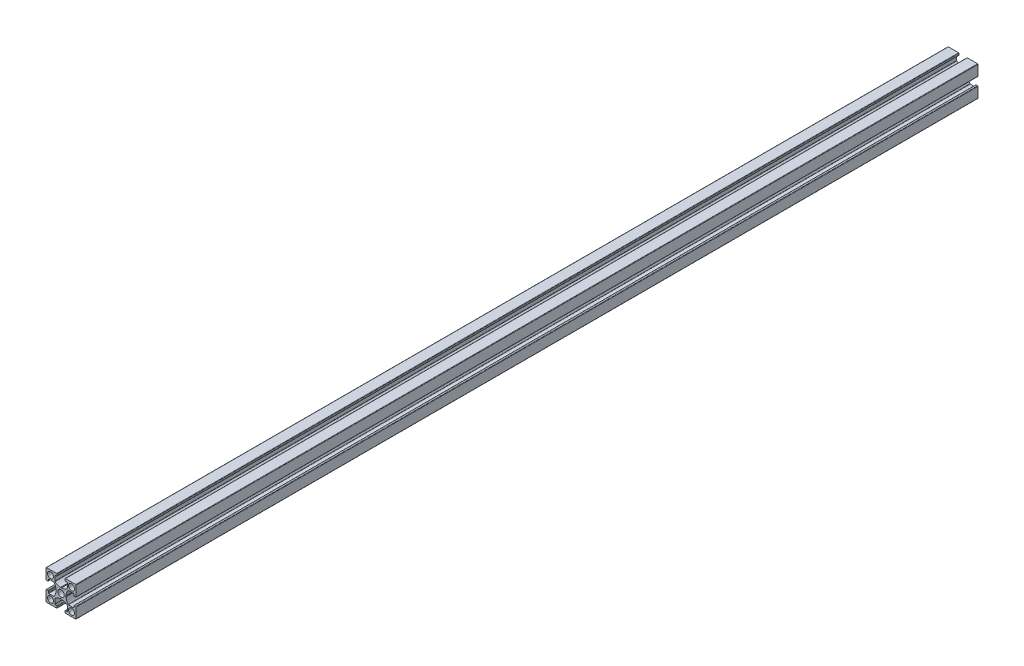
from build123d import *

# Parameters (mm, degrees)
MODEL_R         = 2.15
MODEL_R_2       = 2
EXTRUDE_1_DEPTH = 600


with BuildPart() as part:
    # Model → 보스-돌출1 (new body)
    with BuildSketch(Plane.XY):
        with BuildLine():
            Line((2307.763927197, 1192.134297913), (2307.763927197, 1195.391548465))
            ThreePointArc((2307.763927197, 1195.391548465), (2307.676059232, 1195.603680499), (2307.463927197, 1195.691548465))
            Line((2307.463927197, 1195.691548465), (2306.563927197, 1195.691548465))
            ThreePointArc((2306.563927197, 1195.691548465), (2306.351795163, 1195.779416431), (2306.263927197, 1195.991548465))
            Line((2306.263927197, 1195.991548465), (2306.263927197, 1196.891548465))
            ThreePointArc((2306.263927197, 1196.891548465), (2306.351795163, 1197.103680499), (2306.563927197, 1197.191548465))
            Line((2306.563927197, 1197.191548465), (2313.313927197, 1197.191548465))
            ThreePointArc((2313.313927197, 1197.191548465), (2313.526059232, 1197.103680499), (2313.613927197, 1196.891548465))
            Line((2313.613927197, 1196.891548465), (2313.613927197, 1190.141548465))
            ThreePointArc((2313.613927197, 1190.141548465), (2313.526059232, 1189.929416431), (2313.313927197, 1189.841548465))
            Line((2313.313927197, 1189.841548465), (2312.413927197, 1189.841548465))
            ThreePointArc((2312.413927197, 1189.841548465), (2312.201795163, 1189.929416431), (2312.113927197, 1190.141548465))
            Line((2312.113927197, 1190.141548465), (2312.113927197, 1191.041548465))
            ThreePointArc((2312.113927197, 1191.041548465), (2312.026059232, 1191.253680499), (2311.813927197, 1191.341548465))
            Line((2311.813927197, 1191.341548465), (2308.556676645, 1191.341548465))
            ThreePointArc((2308.556676645, 1191.341548465), (2308.426234796, 1191.311705686), (2308.321744595, 1191.228114625))
            ThreePointArc((2308.321744595, 1191.228114625), (2307.328306374, 1189.47356999), (2306.921204563, 1187.498825831))
            Line((2306.921204563, 1187.498825831), (2306.613927197, 1187.191548465))
            Line((2306.613927197, 1187.191548465), (2306.921204563, 1186.884271099))
            ThreePointArc((2306.921204563, 1186.884271099), (2307.328306374, 1184.90952694), (2308.321744595, 1183.154982305))
            ThreePointArc((2308.321744595, 1183.154982305), (2308.426234796, 1183.071391244), (2308.556676645, 1183.041548465))
            Line((2308.556676645, 1183.041548465), (2311.813927197, 1183.041548465))
            ThreePointArc((2311.813927197, 1183.041548465), (2312.026059232, 1183.129416431), (2312.113927197, 1183.341548465))
            Line((2312.113927197, 1183.341548465), (2312.113927197, 1184.241548465))
            ThreePointArc((2312.113927197, 1184.241548465), (2312.201795163, 1184.453680499), (2312.413927197, 1184.541548465))
            Line((2312.413927197, 1184.541548465), (2313.313927197, 1184.541548465))
            ThreePointArc((2313.313927197, 1184.541548465), (2313.526059232, 1184.453680499), (2313.613927197, 1184.241548465))
            Line((2313.613927197, 1184.241548465), (2313.613927197, 1177.491548465))
            ThreePointArc((2313.613927197, 1177.491548465), (2313.526059232, 1177.279416431), (2313.313927197, 1177.191548465))
            Line((2313.313927197, 1177.191548465), (2306.563927197, 1177.191548465))
            ThreePointArc((2306.563927197, 1177.191548465), (2306.351795163, 1177.279416431), (2306.263927197, 1177.491548465))
            Line((2306.263927197, 1177.491548465), (2306.263927197, 1178.391548465))
            ThreePointArc((2306.263927197, 1178.391548465), (2306.351795163, 1178.603680499), (2306.563927197, 1178.691548465))
            Line((2306.563927197, 1178.691548465), (2307.463927197, 1178.691548465))
            ThreePointArc((2307.463927197, 1178.691548465), (2307.676059232, 1178.779416431), (2307.763927197, 1178.991548465))
            Line((2307.763927197, 1178.991548465), (2307.763927197, 1182.248799017))
            ThreePointArc((2307.763927197, 1182.248799017), (2307.734084418, 1182.379240866), (2307.650493357, 1182.483731067))
            ThreePointArc((2307.650493357, 1182.483731067), (2305.895948722, 1183.477169289), (2303.921204563, 1183.884271099))
            Line((2303.921204563, 1183.884271099), (2303.613927197, 1184.191548465))
            Line((2303.613927197, 1184.191548465), (2303.306649831, 1183.884271099))
            ThreePointArc((2303.306649831, 1183.884271099), (2301.331905673, 1183.477169289), (2299.577361038, 1182.483731067))
            ThreePointArc((2299.577361038, 1182.483731067), (2299.493769977, 1182.379240866), (2299.463927197, 1182.248799017))
            Line((2299.463927197, 1182.248799017), (2299.463927197, 1178.991548465))
            ThreePointArc((2299.463927197, 1178.991548465), (2299.551795163, 1178.779416431), (2299.763927197, 1178.691548465))
            Line((2299.763927197, 1178.691548465), (2300.663927197, 1178.691548465))
            ThreePointArc((2300.663927197, 1178.691548465), (2300.876059232, 1178.603680499), (2300.963927197, 1178.391548465))
            Line((2300.963927197, 1178.391548465), (2300.963927197, 1177.491548465))
            ThreePointArc((2300.963927197, 1177.491548465), (2300.876059232, 1177.279416431), (2300.663927197, 1177.191548465))
            Line((2300.663927197, 1177.191548465), (2293.913927197, 1177.191548465))
            ThreePointArc((2293.913927197, 1177.191548465), (2293.701795163, 1177.279416431), (2293.613927197, 1177.491548465))
            Line((2293.613927197, 1177.491548465), (2293.613927197, 1184.241548465))
            ThreePointArc((2293.613927197, 1184.241548465), (2293.701795163, 1184.453680499), (2293.913927197, 1184.541548465))
            Line((2293.913927197, 1184.541548465), (2294.813927197, 1184.541548465))
            ThreePointArc((2294.813927197, 1184.541548465), (2295.026059232, 1184.453680499), (2295.113927197, 1184.241548465))
            Line((2295.113927197, 1184.241548465), (2295.113927197, 1183.341548465))
            ThreePointArc((2295.113927197, 1183.341548465), (2295.201795163, 1183.129416431), (2295.413927197, 1183.041548465))
            Line((2295.413927197, 1183.041548465), (2298.671177749, 1183.041548465))
            ThreePointArc((2298.671177749, 1183.041548465), (2298.801619599, 1183.071391244), (2298.906109799, 1183.154982305))
            ThreePointArc((2298.906109799, 1183.154982305), (2299.899548021, 1184.90952694), (2300.306649831, 1186.884271099))
            Line((2300.306649831, 1186.884271099), (2300.613927197, 1187.191548465))
            Line((2300.613927197, 1187.191548465), (2300.306649831, 1187.498825831))
            ThreePointArc((2300.306649831, 1187.498825831), (2299.899548021, 1189.47356999), (2298.906109799, 1191.228114625))
            ThreePointArc((2298.906109799, 1191.228114625), (2298.801619599, 1191.311705686), (2298.671177749, 1191.341548465))
            Line((2298.671177749, 1191.341548465), (2295.413927197, 1191.341548465))
            ThreePointArc((2295.413927197, 1191.341548465), (2295.201795163, 1191.253680499), (2295.113927197, 1191.041548465))
            Line((2295.113927197, 1191.041548465), (2295.113927197, 1190.141548465))
            ThreePointArc((2295.113927197, 1190.141548465), (2295.026059232, 1189.929416431), (2294.813927197, 1189.841548465))
            Line((2294.813927197, 1189.841548465), (2293.913927197, 1189.841548465))
            ThreePointArc((2293.913927197, 1189.841548465), (2293.701795163, 1189.929416431), (2293.613927197, 1190.141548465))
            Line((2293.613927197, 1190.141548465), (2293.613927197, 1196.891548465))
            ThreePointArc((2293.613927197, 1196.891548465), (2293.701795163, 1197.103680499), (2293.913927197, 1197.191548465))
            Line((2293.913927197, 1197.191548465), (2300.663927197, 1197.191548465))
            ThreePointArc((2300.663927197, 1197.191548465), (2300.876059232, 1197.103680499), (2300.963927197, 1196.891548465))
            Line((2300.963927197, 1196.891548465), (2300.963927197, 1195.991548465))
            ThreePointArc((2300.963927197, 1195.991548465), (2300.876059232, 1195.779416431), (2300.663927197, 1195.691548465))
            Line((2300.663927197, 1195.691548465), (2299.763927197, 1195.691548465))
            ThreePointArc((2299.763927197, 1195.691548465), (2299.551795163, 1195.603680499), (2299.463927197, 1195.391548465))
            Line((2299.463927197, 1195.391548465), (2299.463927197, 1192.134297913))
            ThreePointArc((2299.463927197, 1192.134297913), (2299.493769977, 1192.003856063), (2299.577361038, 1191.899365863))
            ThreePointArc((2299.577361038, 1191.899365863), (2301.331905673, 1190.905927641), (2303.306649831, 1190.498825831))
            Line((2303.306649831, 1190.498825831), (2303.613927197, 1190.191548465))
            Line((2303.613927197, 1190.191548465), (2303.921204563, 1190.498825831))
            ThreePointArc((2303.921204563, 1190.498825831), (2305.895948722, 1190.905927641), (2307.650493357, 1191.899365863))
            ThreePointArc((2307.650493357, 1191.899365863), (2307.734084418, 1192.003856063), (2307.763927197, 1192.134297913))
        make_face()
        with Locations((2303.613927197, 1187.191548465)):
            Circle(MODEL_R, mode=Mode.SUBTRACT)
        with Locations((2296.613927197, 1194.191548465)):
            Circle(MODEL_R_2, mode=Mode.SUBTRACT)
        with Locations((2296.613927197, 1180.191548465)):
            Circle(MODEL_R_2, mode=Mode.SUBTRACT)
        with Locations((2310.613927197, 1194.191548465)):
            Circle(MODEL_R_2, mode=Mode.SUBTRACT)
        with Locations((2310.613927197, 1180.191548465)):
            Circle(MODEL_R_2, mode=Mode.SUBTRACT)
    extrude(amount=EXTRUDE_1_DEPTH)


solid = part.part
